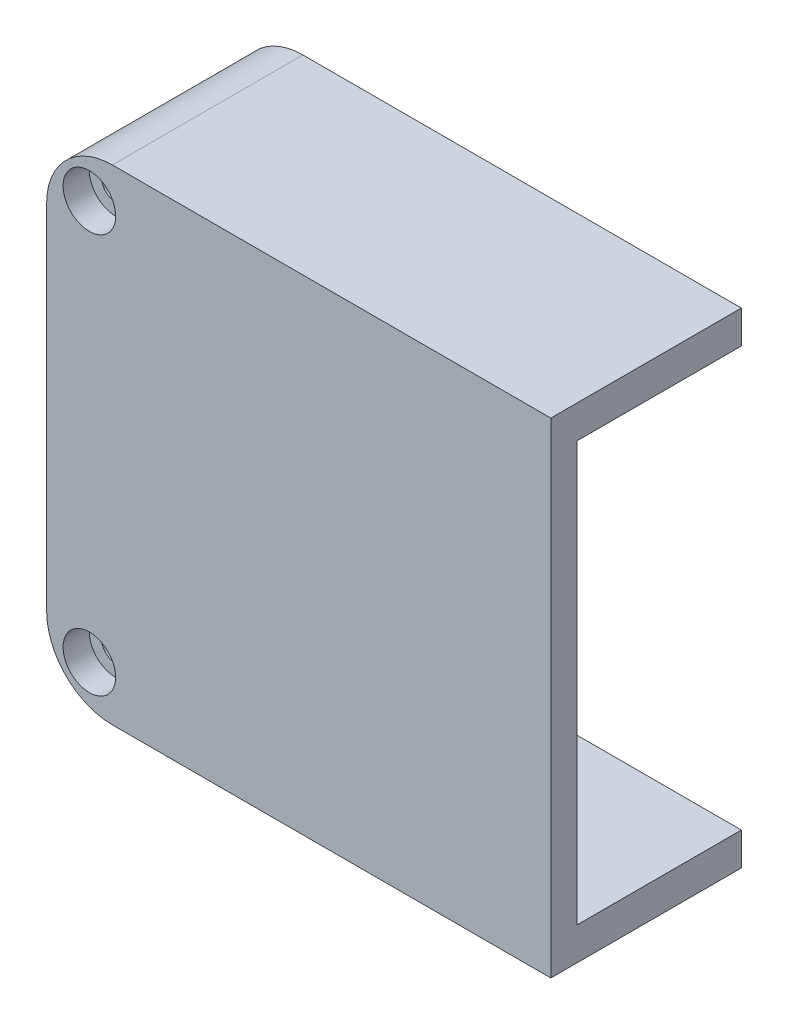
from build123d import *

# Parameters (mm, degrees)
EXTRUDE_THIN1_DEPTH            = 25
BOSS_EXTRUDE1_DEPTH            = 25
SKETCH3_W                      = 76.727105056
SKETCH3_H                      = 73.797041503
BOSS_EXTRUDE2_DEPTH            = 4
FILLET1_R                      = 10
FILLET2_R                      = 5
CBORE_FOR_M4_SHCS1_D           = 4.3
CBORE_FOR_M4_SHCS1_CBORE_D     = 8
CBORE_FOR_M4_SHCS1_CBORE_DEPTH = 4


with BuildPart() as part:
    # Sketch1 → Extrude-Thin1 (new body)
    with BuildSketch(Plane.XY):
        Polygon((-5.007497798, -29.94725217), (-76.734602854, -29.94725217), (-76.734602854, 33.849789333), (-5.007497798, 33.849789333), (-5.007497798, 38.849789333), (-81.734602854, 38.849789333), (-81.734602854, -34.94725217), (-5.007497798, -34.94725217), align=None)
    extrude(amount=EXTRUDE_THIN1_DEPTH)

    # Sketch2 → Boss-Extrude1 (add)
    with BuildSketch(Plane.XY):
        Polygon((-68.24932148, 33.849789333), (-76.734602854, 25.364507959), (-76.734602854, 33.849789333), align=None)
        Polygon((-76.734602854, -29.94725217), (-68.24932148, -29.94725217), (-76.734602854, -21.461970795), align=None)
    extrude(amount=BOSS_EXTRUDE1_DEPTH)

    # Sketch3 → Boss-Extrude2 (add)
    with BuildSketch(Plane.XY.offset(25)):
        with Locations((-43.371050326, 1.951268582)):
            Rectangle(SKETCH3_W, SKETCH3_H)
    extrude(amount=BOSS_EXTRUDE2_DEPTH)

    # Fillet1
    fillet1_edges = [part.edges().sort_by_distance(p)[0] for p in [
        (-81.734602854, -34.94725217, 14.5),
        (-81.734602854, 38.849789333, 14.5),
    ]]
    fillet(fillet1_edges, radius=FILLET1_R)

    # Fillet2
    fillet2_edges = [part.edges().sort_by_distance(p)[0] for p in [
        (-68.24932148, -29.94725217, 12.5),
        (-76.734602854, -21.461970795, 12.5),
        (-68.24932148, 33.849789333, 12.5),
        (-76.734602854, 25.364507959, 12.5),
    ]]
    fillet(fillet2_edges, radius=FILLET2_R)

    # CBORE for M4 SHCS1 (through all)
    with Locations(Plane(origin=(-75.234602854, 32.349789333, 29), x_dir=(1, 0, 0), z_dir=(0, 0, 1))):
        with Locations((0, 0), (0, -60.797041503)):
            CounterBoreHole(CBORE_FOR_M4_SHCS1_D / 2, CBORE_FOR_M4_SHCS1_CBORE_D / 2, CBORE_FOR_M4_SHCS1_CBORE_DEPTH)


solid = part.part
